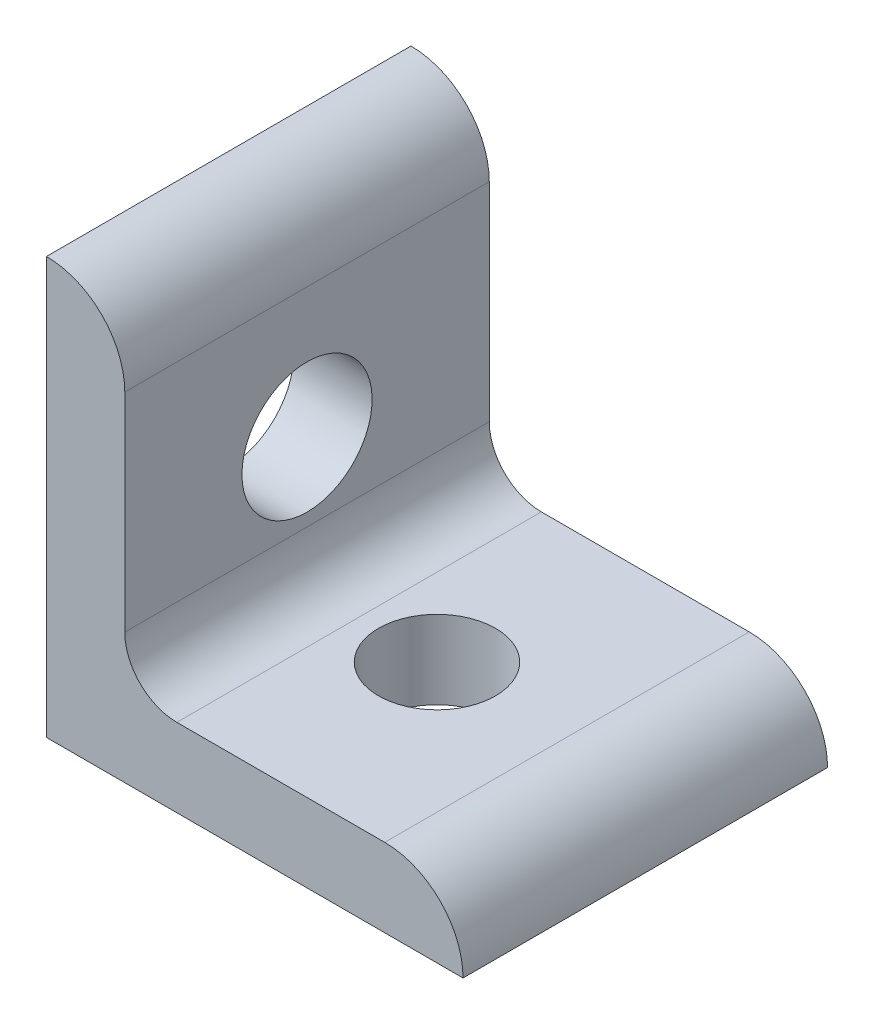
from build123d import *

# Parameters (mm, degrees)
BOSS_EXTRUDE1_DEPTH         = 11.1125
SKETCH2_R                   = 3.5687
CUT_EXTRUDE1_DEPTH          = 38.600633721
SKETCH3_R                   = 3.5687
CUT_EXTRUDE2_DEPTH          = 38.600633721
F_3_8_16_TAPPED_HOLE1_D     = 7.9375
F_3_8_16_TAPPED_HOLE1_DEPTH = 23.8125
F_3_8_16_TAPPED_HOLE1_TIP   = 2.384665582


with BuildPart() as part:
    # Sketch1 → Boss-Extrude1 (new, symmetric)
    with BuildSketch(Plane.XY):
        with BuildLine():
            Line((0, 0), (0, 25.4))
            ThreePointArc((0, 25.4), (3.376576302, 24.001376302), (4.7752, 20.6248))
            Line((4.7752, 20.6248), (4.7752, 7.9502))
            ThreePointArc((4.7752, 7.9502), (5.70513597, 5.70513597), (7.9502, 4.7752))
            Line((7.9502, 4.7752), (20.6248, 4.7752))
            ThreePointArc((20.6248, 4.7752), (24.001376302, 3.376576302), (25.4, 0))
            Line((25.4, 0), (0, 0))
        make_face()
    extrude(amount=BOSS_EXTRUDE1_DEPTH, both=True)

    # Sketch2 → Cut-Extrude1 (cut, through all)
    with BuildSketch(Plane(origin=(0, 0, 0), x_dir=(1, 0, 0), z_dir=(0, 1, 0))):
        with Locations(Location((12.7, 0, 0), (0, 0, 90))):
            Circle(SKETCH2_R)
    extrude(amount=CUT_EXTRUDE1_DEPTH, mode=Mode.SUBTRACT)

    # Sketch3 → Cut-Extrude2 (cut, through all)
    with BuildSketch(Plane(origin=(0, 0, 0), x_dir=(0, 0, -1), z_dir=(1, 0, 0))):
        with Locations(Location((0, 12.7, 0), (0, 0, 270))):
            Circle(SKETCH3_R)
    extrude(amount=CUT_EXTRUDE2_DEPTH, mode=Mode.SUBTRACT)

    # 3/8-16 Tapped Hole1
    with Locations(Plane.ZY):
        with Locations((0, 12.7)):
            Hole(F_3_8_16_TAPPED_HOLE1_D / 2, depth=F_3_8_16_TAPPED_HOLE1_DEPTH)
            with Locations((0, 0, -(F_3_8_16_TAPPED_HOLE1_DEPTH + F_3_8_16_TAPPED_HOLE1_TIP / 2))):  # 118° drill point
                Cone(0, F_3_8_16_TAPPED_HOLE1_D / 2, F_3_8_16_TAPPED_HOLE1_TIP, mode=Mode.SUBTRACT)


solid = part.part
